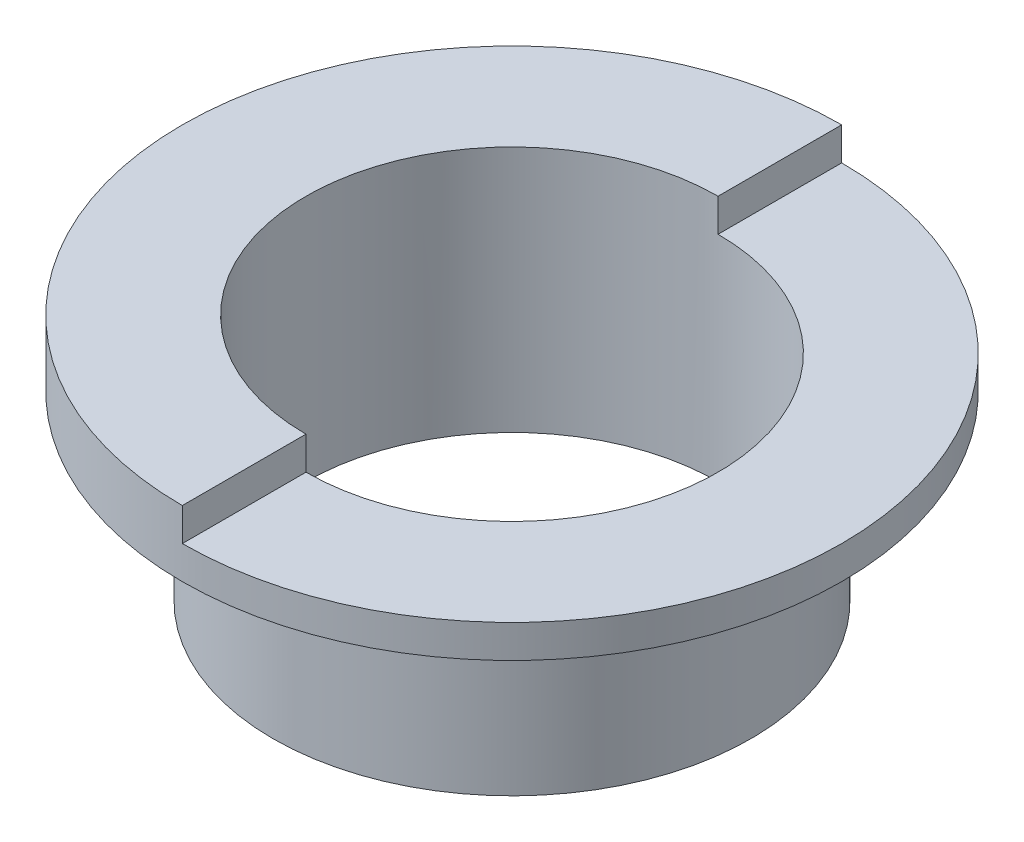
from build123d import *

# Parameters (mm, degrees)
SKETCH_2_R      = 14.5
SKETCH_2_R_2    = 12.5
EXTRUDE_1_DEPTH = 11
SKETCH_3_R      = 20
SKETCH_3_R_2    = 12.5
EXTRUDE_2_DEPTH = 2
EXTRUDE_3_DEPTH = 2


with BuildPart() as part:
    # 草圖2 → 填料-伸長1 (new body)
    with BuildSketch(Plane(origin=(0, 0, 0), x_dir=(1, 0, 0), z_dir=(0, 1, 0))):
        with Locations(Location((0, 0, 0), (0, 0, 270))):
            Circle(SKETCH_2_R)
        with Locations(Location((0, 0, 0), (0, 0, 270))):
            Circle(SKETCH_2_R_2, mode=Mode.SUBTRACT)
    extrude(amount=EXTRUDE_1_DEPTH)

    # 草圖3 → 填料-伸長2 (add)
    with BuildSketch(Plane(origin=(0, 11, 0), x_dir=(1, 0, 0), z_dir=(0, 1, 0))):
        with Locations(Location((0, 0, 0), (0, 0, 270))):
            Circle(SKETCH_3_R)
        with Locations(Location((0, 0, 0), (0, 0, 270))):
            Circle(SKETCH_3_R_2, mode=Mode.SUBTRACT)
    extrude(amount=EXTRUDE_2_DEPTH)

    # 草圖4 → 填料-伸長3 (add)
    with BuildSketch(Plane(origin=(0, 13, 0), x_dir=(1, 0, 0), z_dir=(0, 1, 0))):
        with BuildLine():
            Line((0, 20), (0, 12.5))
            ThreePointArc((0, 12.5), (-12.5, 0), (0, -12.5))
            Line((0, -12.5), (0, -20))
            ThreePointArc((0, -20), (-20, 0), (0, 20))
        make_face()
    extrude(amount=EXTRUDE_3_DEPTH)


solid = part.part
